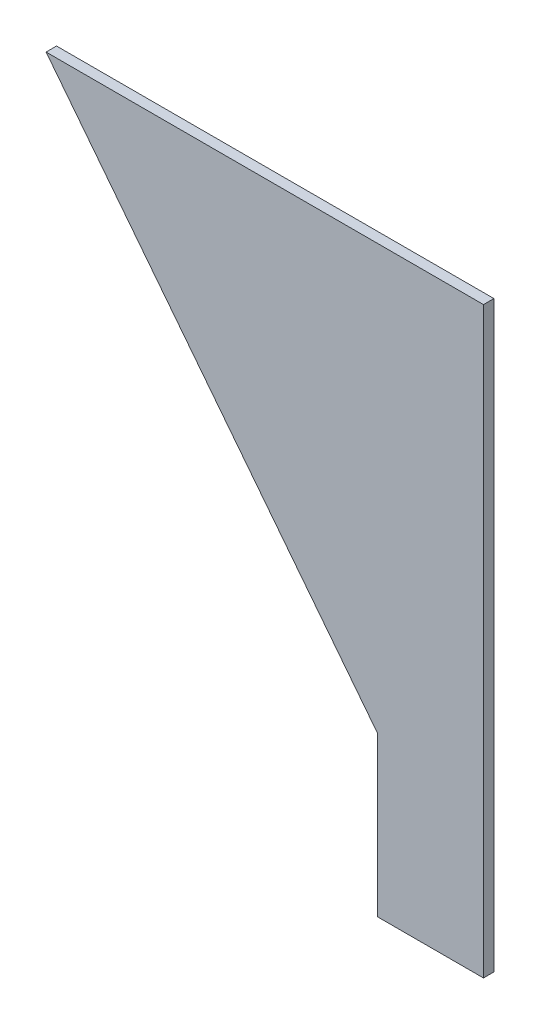
from build123d import *

# Parameters (mm, degrees)
EXTRUDE_1_DEPTH = 5


with BuildPart() as part:
    # 草图1 → 凸台-拉伸1 (new body)
    with BuildSketch(Plane.XY):
        Polygon((-95.25, 0), (-95.25, -76.2), (-146.05, -76.2), (-146.05, 0), (-304.8, 203.2), (-95.25, 203.2), align=None)
    extrude(amount=EXTRUDE_1_DEPTH)


solid = part.part
